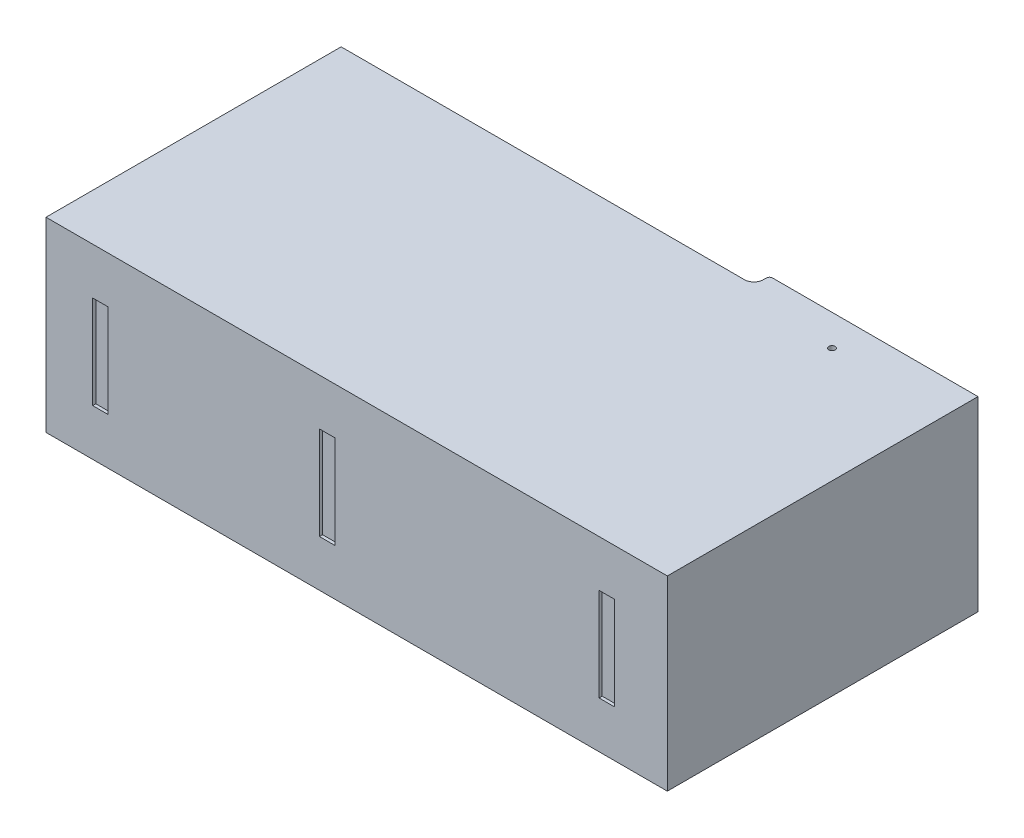
from build123d import *

# Parameters (mm, degrees)
SALIENTE_EXTRUIR2_DEPTH = 6
REDONDEO1_R             = 0.1
CROQUIS3_W              = 2
CROQUIS3_H              = 3.3
CORTAR_EXTRUIR2_DEPTH   = 5
CROQUIS4_R              = 0.1
CORTAR_EXTRUIR3_DEPTH   = 6
CROQUIS5_W              = 0.5
CROQUIS5_H              = 3
CORTAR_EXTRUIR4_DEPTH   = 0.1


with BuildPart() as part:
    # Croquis1 → Saliente-Extruir2 (new body)
    with BuildSketch(Plane(origin=(0, 0, 0), x_dir=(1, 0, 0), z_dir=(0, 1, 0))):
        with BuildLine():
            Line((2.986733927, 4.5), (-10, 4.5))
            Line((-10, 4.5), (-10, -5))
            Line((-10, -5), (10, -5))
            Line((10, -5), (10, 5))
            Line((10, 5), (3.286733927, 5))
            Line((3.286733927, 5), (3.286733927, 4.8))
            ThreePointArc((3.286733927, 4.8), (3.198865961, 4.587867966), (2.986733927, 4.5))
        make_face()
    extrude(amount=SALIENTE_EXTRUIR2_DEPTH)

    # Redondeo1
    redondeo1_edges = [part.edges().sort_by_distance(p)[0] for p in [
        (3.286733927, 3, -5),
    ]]
    fillet(redondeo1_edges, radius=REDONDEO1_R)

    # Croquis3 → Cortar-Extruir2 (cut)
    with BuildSketch(Plane(origin=(0, 0, -4.5), x_dir=(-1, 0, 0), z_dir=(0, 0, -1))):
        with Locations((-0.386733927, 3)):
            Rectangle(CROQUIS3_W, CROQUIS3_H)
    extrude(amount=-CORTAR_EXTRUIR2_DEPTH, mode=Mode.SUBTRACT)

    # Croquis4 → Cortar-Extruir3 (cut)
    with BuildSketch(Plane(origin=(0, 6, 0), x_dir=(1, 0, 0), z_dir=(0, 1, 0))):
        with Locations(Location((6.3, 4, 0), (0, 0, 270))):
            Circle(CROQUIS4_R)
    extrude(amount=-CORTAR_EXTRUIR3_DEPTH, mode=Mode.SUBTRACT)

    # Croquis5 → Cortar-Extruir4 (cut)
    with BuildSketch(Plane.XY.offset(5)):
        with Locations((-8.247200411, 3)):
            Rectangle(CROQUIS5_W, CROQUIS5_H)
        with Locations((-0.947200411, 3)):
            Rectangle(CROQUIS5_W, CROQUIS5_H)
        with Locations((8.052799589, 3)):
            Rectangle(CROQUIS5_W, CROQUIS5_H)
    extrude(amount=-CORTAR_EXTRUIR4_DEPTH, mode=Mode.SUBTRACT)


solid = part.part
